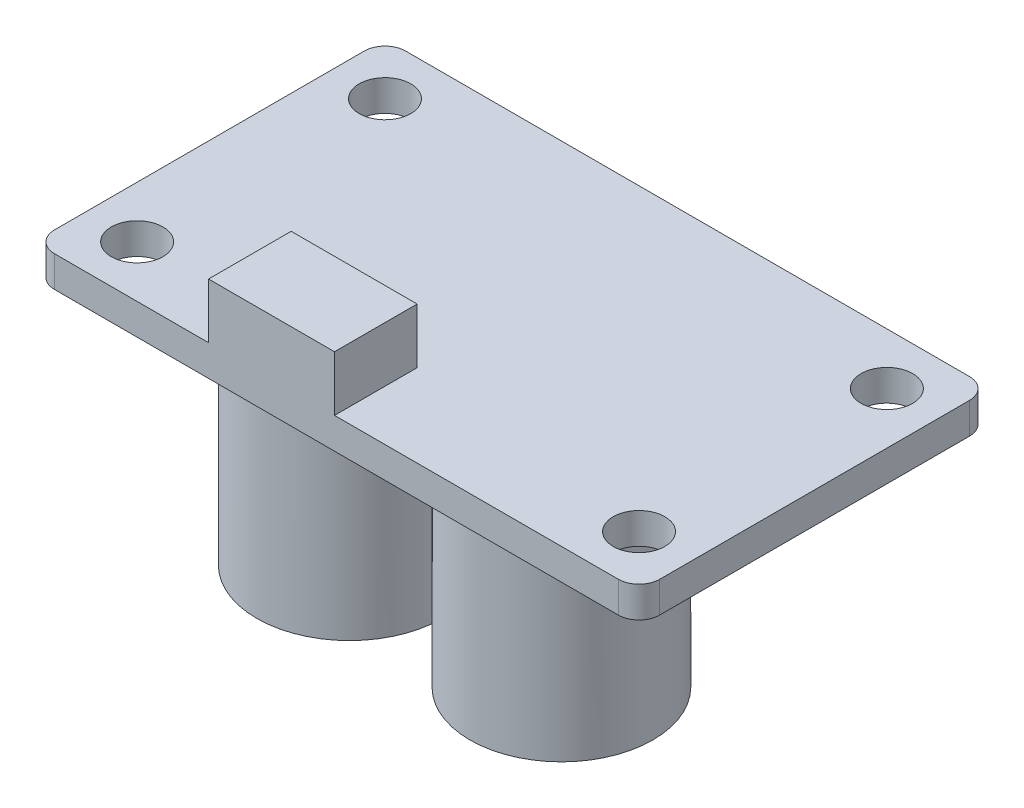
from build123d import *

# Parameters (mm, degrees)
SKETCH_1_W          = 29.3
SKETCH_1_H          = 17
EXTRUDE_1_DEPTH     = 1.5
SKETCH_2_R          = 1.25
CUT_EXTRUDE_1_DEPTH = 18.003602559
SKETCH_4_W          = 6.098514982
SKETCH_4_H          = 2.670072728
EXTRUDE_2_DEPTH     = 4
SKETCH_5_R          = 4.492338227
SKETCH_5_R_2        = 4.429267197
EXTRUDE_3_DEPTH     = 10
SKETCH_6_R          = 2.746946082
EXTRUDE_4_DEPTH     = 2
FILLET_1_R          = 1


with BuildPart() as part:
    # 草图1 → 凸台-拉伸1 (new body)
    with BuildSketch(Plane(origin=(0, 0, 0), x_dir=(1, 0, 0), z_dir=(0, 1, 0))):
        Rectangle(SKETCH_1_W, SKETCH_1_H)
    extrude(amount=EXTRUDE_1_DEPTH)

    # 草图2 → 切除-拉伸1 (cut, through all)
    with BuildSketch(Plane(origin=(0, 1.5, 0), x_dir=(1, 0, 0), z_dir=(0, 1, 0))):
        with Locations(Location((-12.15, 6, 0), (0, 0, 270))):
            Circle(SKETCH_2_R)
        with Locations(Location((12.15, 6, 0), (0, 0, 90))):
            Circle(SKETCH_2_R)
        with Locations(Location((12.15, -6, 0), (0, 0, 270))):
            Circle(SKETCH_2_R)
        with Locations(Location((-12.15, -6, 0), (0, 0, 90))):
            Circle(SKETCH_2_R)
    extrude(amount=-CUT_EXTRUDE_1_DEPTH, mode=Mode.SUBTRACT)

    # 草图4 → 凸台-拉伸2 (add)
    with BuildSketch(Plane.XY.offset(8.5)):
        with Locations((-3.14217972, 2.835036364)):
            Rectangle(SKETCH_4_W, SKETCH_4_H)
    extrude(amount=-EXTRUDE_2_DEPTH)

    # 草图5 → 凸台-拉伸3 (add)
    with BuildSketch(Plane.XZ):
        with Locations(Location((-4.961846609, 2.903857851, 0), (0, 0, 90))):
            Circle(SKETCH_5_R)
        with Locations(Location((5.295992796, 2.903857851, 0), (0, 0, 90))):
            Circle(SKETCH_5_R_2)
    extrude(amount=EXTRUDE_3_DEPTH)

    # 草图6 → 凸台-拉伸4 (add)
    with BuildSketch(Plane.XZ):
        with Locations(Location((0, -5.440327707, 0), (0, 0, 90))):
            Circle(SKETCH_6_R)
    extrude(amount=EXTRUDE_4_DEPTH)

    # 圆角1
    fillet_1_edges = [part.edges().sort_by_distance(p)[0] for p in [
        (14.65, 0.75, 8.5),
        (-14.65, 0.75, 8.5),
        (-14.65, 0.75, -8.5),
        (14.65, 0.75, -8.5),
    ]]
    fillet(fillet_1_edges, radius=FILLET_1_R)


solid = part.part
